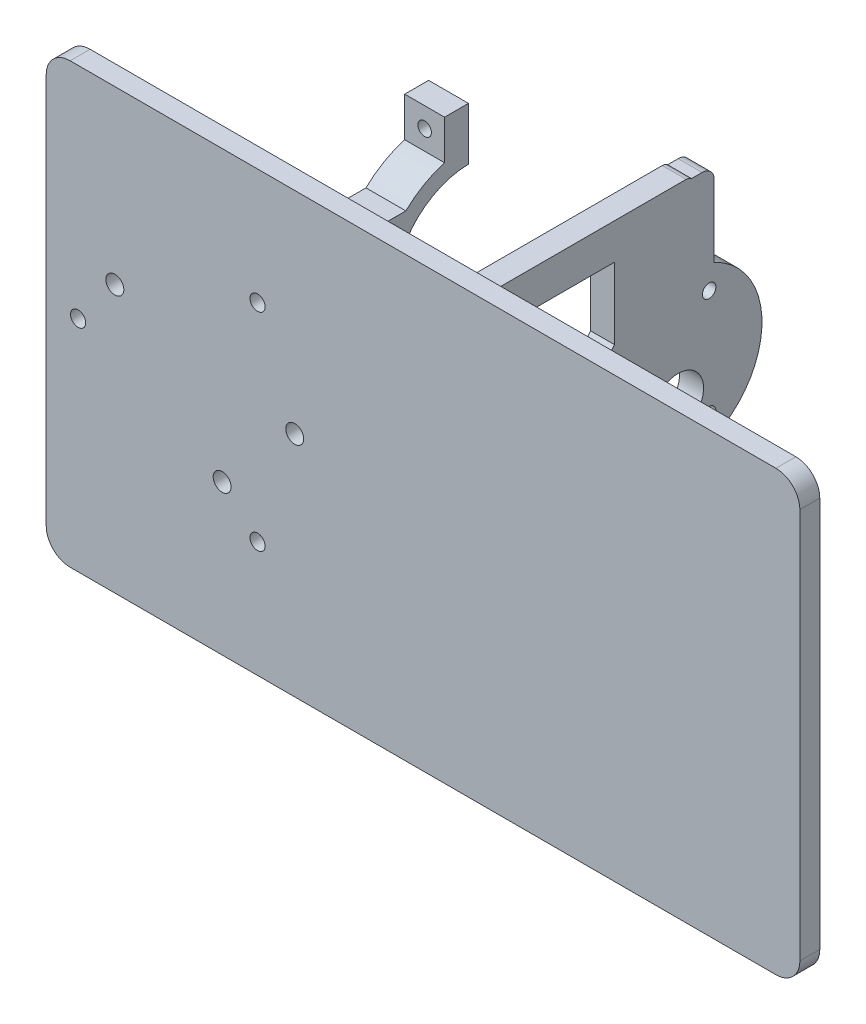
from build123d import *

# Parameters (mm, degrees)
F_01_SOLID_CASSETTE_DECK_DEPTH                 = 5
F_02_START                                     = -0.5
S02_THREE_MODULE_ATTACHMENT_HOLES_R            = 2.25
F_02_THREE_MODULE_ATTACHMENT_HOLES_DEPTH       = 6
F_03_START                                     = -0.5
S03_THREE_TENDON_PASSAGES_R                    = 1.9
F_03_THREE_TENDON_PASSAGES_DEPTH               = 6
F_04_START                                     = 29.980762114
S04_SHEAVE_1_INTEGRAL_CHEEK_1_R                = 2.2
F_04_SHEAVE_1_INTEGRAL_CHEEK_1_DEPTH           = 4
F_05_START                                     = 17.980762114
S05_SHEAVE_1_INTEGRAL_CHEEK_2_R                = 2.2
F_05_SHEAVE_1_INTEGRAL_CHEEK_2_DEPTH           = 4
F_06_START                                     = -21.980762114
S06_SHEAVE_2_INTEGRAL_CHEEK_1_R                = 2.2
F_06_SHEAVE_2_INTEGRAL_CHEEK_1_DEPTH           = 4
F_07_START                                     = -33.980762114
S07_SHEAVE_2_INTEGRAL_CHEEK_2_R                = 2.2
F_07_SHEAVE_2_INTEGRAL_CHEEK_2_DEPTH           = 4
F_08_START                                     = 4
S08_SHEAVE_3_INTEGRAL_CHEEK_1_R                = 2.2
F_08_SHEAVE_3_INTEGRAL_CHEEK_1_DEPTH           = 4
F_09_START                                     = -8
S09_SHEAVE_3_INTEGRAL_CHEEK_2_R                = 2.2
F_09_SHEAVE_3_INTEGRAL_CHEEK_2_DEPTH           = 4
F_10_START                                     = 57.5
F_10_OUTER_MOTOR_SUPPORT_43_DEPTH              = 6
F_11_START                                     = 57.5
F_11_OUTER_MOTOR_SUPPORT_43_DEPTH              = 6
F_12_START                                     = 57.5
F_12_MOTOR_FLANGE_CROSSMEMBER_BELOW_CORD_DEPTH = 6
F_13_START                                     = 57.5
S13_37D_FLANGE_BEARING_LAND_R                  = 21
F_13_37D_FLANGE_BEARING_LAND_DEPTH             = 6
F_14_START                                     = 57.3
S14_37D_PILOT_AND_THREE_M3_FACE_HOLES_R        = 6.35
S14_37D_PILOT_AND_THREE_M3_FACE_HOLES_R_2      = 1.7
F_14_37D_PILOT_AND_THREE_M3_FACE_HOLES_DEPTH   = 6.4
F_15_START                                     = 1.2
S15_REAR_MOTOR_CRADLE_ROOT_1_W                 = 40.8
S15_REAR_MOTOR_CRADLE_ROOT_1_H                 = 7
F_15_REAR_MOTOR_CRADLE_ROOT_1_DEPTH            = 10
F_16_START                                     = 1.2
S16_REAR_MOTOR_CRADLE_ROOT_2_W                 = 40.8
S16_REAR_MOTOR_CRADLE_ROOT_2_H                 = 7
F_16_REAR_MOTOR_CRADLE_ROOT_2_DEPTH            = 10
F_17_START                                     = 1.2
F_17_INTEGRAL_REAR_MOTOR_SADDLE_DEPTH          = 10
F_18_START                                     = 1
S18_37D_REAR_CAN_SUPPORT_R                     = 17.4
F_18_37D_REAR_CAN_SUPPORT_DEPTH                = 10.4
F_19_START                                     = 7.7
S19_LEAD_IN_CLEARANCE_FOR_GEARBOX_INST_R       = 18.8
F_19_LEAD_IN_CLEARANCE_FOR_GEARBOX_INSTA_DEPTH = 3.7
F_20_START                                     = -52
S20_MOTOR_SADDLE_CLAMP_SCREW_HOLES_R           = 1.7
F_20_MOTOR_SADDLE_CLAMP_SCREW_HOLES_DEPTH      = 7


with BuildPart() as part:
    # S01 - Solid cassette deck → 01 - Solid cassette deck (new body)
    with BuildSketch(Plane.XY):
        with BuildLine():
            Line((-32, -55), (145, -55))
            ThreePointArc((145, -55), (149.242640687, -53.242640687), (151, -49))
            Line((151, -49), (151, 49))
            ThreePointArc((151, 49), (149.242640687, 53.242640687), (145, 55))
            Line((145, 55), (-32, 55))
            ThreePointArc((-32, 55), (-36.242640687, 53.242640687), (-38, 49))
            Line((-38, 49), (-38, -49))
            ThreePointArc((-38, -49), (-36.242640687, -53.242640687), (-32, -55))
        make_face()
    extrude(amount=F_01_SOLID_CASSETTE_DECK_DEPTH)

    # S02 - Three module attachment holes → 02 - Three module attachment holes (cut)
    with BuildSketch(Plane.XY.offset(F_02_START)):
        with Locations((6.124355653, -17.392304845)):
            Circle(S02_THREE_MODULE_ATTACHMENT_HOLES_R)
        with Locations((24.320508076, 2.124355653)):
            Circle(S02_THREE_MODULE_ATTACHMENT_HOLES_R)
        with Locations((-20.784609691, 12)):
            Circle(S02_THREE_MODULE_ATTACHMENT_HOLES_R)
    extrude(amount=F_02_THREE_MODULE_ATTACHMENT_HOLES_DEPTH, mode=Mode.SUBTRACT)

    # S03 - Three tendon passages → 03 - Three tendon passages (cut)
    with BuildSketch(Plane.XY.offset(F_03_START)):
        with Locations((15, -25.980762114)):
            Circle(S03_THREE_TENDON_PASSAGES_R)
        with Locations((15, 25.980762114)):
            Circle(S03_THREE_TENDON_PASSAGES_R)
        with Locations((-30, 0)):
            Circle(S03_THREE_TENDON_PASSAGES_R)
    extrude(amount=F_03_THREE_TENDON_PASSAGES_DEPTH, mode=Mode.SUBTRACT)

    # S04 - Sheave 1 integral cheek 1 → 04 - Sheave 1 integral cheek 1 (add)
    with BuildSketch(Plane(origin=(0, 0, 0), x_dir=(-1, 0, 0), z_dir=(0, -1, 0)).offset(F_04_START)):
        with BuildLine():
            Line((-19.035615808, 14.404273897), (-20.535615808, 1.904273897))
            ThreePointArc((-20.535615808, 1.904273897), (-26.095726103, -2.464384192), (-30.464384192, 3.095726103))
            Line((-30.464384192, 3.095726103), (-28.964384192, 15.595726103))
            ThreePointArc((-28.964384192, 15.595726103), (-23.404273897, 19.964384192), (-19.035615808, 14.404273897))
        make_face()
        with Locations((-24, 15)):
            Circle(S04_SHEAVE_1_INTEGRAL_CHEEK_1_R, mode=Mode.SUBTRACT)
    extrude(amount=F_04_SHEAVE_1_INTEGRAL_CHEEK_1_DEPTH)

    # S05 - Sheave 1 integral cheek 2 → 05 - Sheave 1 integral cheek 2 (add)
    with BuildSketch(Plane(origin=(0, 0, 0), x_dir=(-1, 0, 0), z_dir=(0, -1, 0)).offset(F_05_START)):
        with BuildLine():
            Line((-19.035615808, 14.404273897), (-20.535615808, 1.904273897))
            ThreePointArc((-20.535615808, 1.904273897), (-26.095726103, -2.464384192), (-30.464384192, 3.095726103))
            Line((-30.464384192, 3.095726103), (-28.964384192, 15.595726103))
            ThreePointArc((-28.964384192, 15.595726103), (-23.404273897, 19.964384192), (-19.035615808, 14.404273897))
        make_face()
        with Locations((-24, 15)):
            Circle(S05_SHEAVE_1_INTEGRAL_CHEEK_2_R, mode=Mode.SUBTRACT)
    extrude(amount=F_05_SHEAVE_1_INTEGRAL_CHEEK_2_DEPTH)

    # S06 - Sheave 2 integral cheek 1 → 06 - Sheave 2 integral cheek 1 (add)
    with BuildSketch(Plane(origin=(0, 0, 0), x_dir=(-1, 0, 0), z_dir=(0, -1, 0)).offset(F_06_START)):
        with BuildLine():
            Line((-19.035615808, 14.404273897), (-20.535615808, 1.904273897))
            ThreePointArc((-20.535615808, 1.904273897), (-26.095726103, -2.464384192), (-30.464384192, 3.095726103))
            Line((-30.464384192, 3.095726103), (-28.964384192, 15.595726103))
            ThreePointArc((-28.964384192, 15.595726103), (-23.404273897, 19.964384192), (-19.035615808, 14.404273897))
        make_face()
        with Locations((-24, 15)):
            Circle(S06_SHEAVE_2_INTEGRAL_CHEEK_1_R, mode=Mode.SUBTRACT)
    extrude(amount=F_06_SHEAVE_2_INTEGRAL_CHEEK_1_DEPTH)

    # S07 - Sheave 2 integral cheek 2 → 07 - Sheave 2 integral cheek 2 (add)
    with BuildSketch(Plane(origin=(0, 0, 0), x_dir=(-1, 0, 0), z_dir=(0, -1, 0)).offset(F_07_START)):
        with BuildLine():
            Line((-19.035615808, 14.404273897), (-20.535615808, 1.904273897))
            ThreePointArc((-20.535615808, 1.904273897), (-26.095726103, -2.464384192), (-30.464384192, 3.095726103))
            Line((-30.464384192, 3.095726103), (-28.964384192, 15.595726103))
            ThreePointArc((-28.964384192, 15.595726103), (-23.404273897, 19.964384192), (-19.035615808, 14.404273897))
        make_face()
        with Locations((-24, 15)):
            Circle(S07_SHEAVE_2_INTEGRAL_CHEEK_2_R, mode=Mode.SUBTRACT)
    extrude(amount=F_07_SHEAVE_2_INTEGRAL_CHEEK_2_DEPTH)

    # S08 - Sheave 3 integral cheek 1 → 08 - Sheave 3 integral cheek 1 (add)
    with BuildSketch(Plane(origin=(0, 0, 0), x_dir=(-1, 0, 0), z_dir=(0, -1, 0)).offset(F_08_START)):
        with BuildLine():
            Line((25.964384192, 14.404273897), (24.464384192, 1.904273897))
            ThreePointArc((24.464384192, 1.904273897), (18.904273897, -2.464384192), (14.535615808, 3.095726103))
            Line((14.535615808, 3.095726103), (16.035615808, 15.595726103))
            ThreePointArc((16.035615808, 15.595726103), (21.595726103, 19.964384192), (25.964384192, 14.404273897))
        make_face()
        with Locations((21, 15)):
            Circle(S08_SHEAVE_3_INTEGRAL_CHEEK_1_R, mode=Mode.SUBTRACT)
    extrude(amount=F_08_SHEAVE_3_INTEGRAL_CHEEK_1_DEPTH)

    # S09 - Sheave 3 integral cheek 2 → 09 - Sheave 3 integral cheek 2 (add)
    with BuildSketch(Plane(origin=(0, 0, 0), x_dir=(-1, 0, 0), z_dir=(0, -1, 0)).offset(F_09_START)):
        with BuildLine():
            Line((25.964384192, 14.404273897), (24.464384192, 1.904273897))
            ThreePointArc((24.464384192, 1.904273897), (18.904273897, -2.464384192), (14.535615808, 3.095726103))
            Line((14.535615808, 3.095726103), (16.035615808, 15.595726103))
            ThreePointArc((16.035615808, 15.595726103), (21.595726103, 19.964384192), (25.964384192, 14.404273897))
        make_face()
        with Locations((21, 15)):
            Circle(S09_SHEAVE_3_INTEGRAL_CHEEK_2_R, mode=Mode.SUBTRACT)
    extrude(amount=F_09_SHEAVE_3_INTEGRAL_CHEEK_2_DEPTH)

    # S10 - Outer motor support -43 → 10 - Outer motor support -43 (add)
    with BuildSketch(Plane(origin=(0, 0, 0), x_dir=(0, 0, -1), z_dir=(1, 0, 0)).offset(F_10_START)):
        with BuildLine():
            Line((56, -45.5), (56, -40.5))
            ThreePointArc((56, -40.5), (55.414213562, -39.085786438), (54, -38.5))
            Line((54, -38.5), (0, -38.5))
            ThreePointArc((0, -38.5), (-1.414213562, -39.085786438), (-2, -40.5))
            Line((-2, -40.5), (-2, -45.5))
            ThreePointArc((-2, -45.5), (-1.414213562, -46.914213562), (0, -47.5))
            Line((0, -47.5), (54, -47.5))
            ThreePointArc((54, -47.5), (55.414213562, -46.914213562), (56, -45.5))
        make_face()
    extrude(amount=F_10_OUTER_MOTOR_SUPPORT_43_DEPTH)

    # S11 - Outer motor support 43 → 11 - Outer motor support 43 (add)
    with BuildSketch(Plane(origin=(0, 0, 0), x_dir=(0, 0, -1), z_dir=(1, 0, 0)).offset(F_11_START)):
        with BuildLine():
            Line((56, 40.5), (56, 45.5))
            ThreePointArc((56, 45.5), (55.414213562, 46.914213562), (54, 47.5))
            Line((54, 47.5), (0, 47.5))
            ThreePointArc((0, 47.5), (-1.414213562, 46.914213562), (-2, 45.5))
            Line((-2, 45.5), (-2, 40.5))
            ThreePointArc((-2, 40.5), (-1.414213562, 39.085786438), (0, 38.5))
            Line((0, 38.5), (54, 38.5))
            ThreePointArc((54, 38.5), (55.414213562, 39.085786438), (56, 40.5))
        make_face()
    extrude(amount=F_11_OUTER_MOTOR_SUPPORT_43_DEPTH)

    # S12 - Motor flange crossmember below cords → 12 - Motor flange crossmember below cords (add)
    with BuildSketch(Plane(origin=(0, 0, 0), x_dir=(0, 0, -1), z_dir=(1, 0, 0)).offset(F_12_START)):
        with BuildLine():
            Line((61, -44), (61, 44))
            ThreePointArc((61, 44), (60.121320344, 46.121320344), (58, 47))
            Line((58, 47), (39, 47))
            ThreePointArc((39, 47), (36.878679656, 46.121320344), (36, 44))
            Line((36, 44), (36, -44))
            ThreePointArc((36, -44), (36.878679656, -46.121320344), (39, -47))
            Line((39, -47), (58, -47))
            ThreePointArc((58, -47), (60.121320344, -46.121320344), (61, -44))
        make_face()
    extrude(amount=F_12_MOTOR_FLANGE_CROSSMEMBER_BELOW_CORD_DEPTH)

    # S13 - 37D flange bearing land → 13 - 37D flange bearing land (add)
    with BuildSketch(Plane(origin=(0, 0, 0), x_dir=(0, 0, -1), z_dir=(1, 0, 0)).offset(F_13_START)):
        with Locations((52, 7)):
            Circle(S13_37D_FLANGE_BEARING_LAND_R)
    extrude(amount=F_13_37D_FLANGE_BEARING_LAND_DEPTH)

    # S14 - 37D pilot and three M3 face holes → 14 - 37D pilot and three M3 face holes (cut)
    with BuildSketch(Plane(origin=(0, 0, 0), x_dir=(0, 0, -1), z_dir=(1, 0, 0)).offset(F_14_START)):
        with Locations((52, 0)):
            Circle(S14_37D_PILOT_AND_THREE_M3_FACE_HOLES_R)
        with Locations((36.5, 7)):
            Circle(S14_37D_PILOT_AND_THREE_M3_FACE_HOLES_R_2)
        with Locations((59.75, -6.423393759)):
            Circle(S14_37D_PILOT_AND_THREE_M3_FACE_HOLES_R_2)
        with Locations((59.75, 20.423393759)):
            Circle(S14_37D_PILOT_AND_THREE_M3_FACE_HOLES_R_2)
    extrude(amount=F_14_37D_PILOT_AND_THREE_M3_FACE_HOLES_DEPTH, mode=Mode.SUBTRACT)

    # S15 - Rear motor cradle root 1 → 15 - Rear motor cradle root 1 (add)
    with BuildSketch(Plane(origin=(0, 0, 0), x_dir=(0, 0, -1), z_dir=(1, 0, 0)).offset(F_15_START)):
        with Locations((19.6, -10)):
            Rectangle(S15_REAR_MOTOR_CRADLE_ROOT_1_W, S15_REAR_MOTOR_CRADLE_ROOT_1_H)
    extrude(amount=F_15_REAR_MOTOR_CRADLE_ROOT_1_DEPTH)

    # S16 - Rear motor cradle root 2 → 16 - Rear motor cradle root 2 (add)
    with BuildSketch(Plane(origin=(0, 0, 0), x_dir=(0, 0, -1), z_dir=(1, 0, 0)).offset(F_16_START)):
        with Locations((19.6, 20)):
            Rectangle(S16_REAR_MOTOR_CRADLE_ROOT_2_W, S16_REAR_MOTOR_CRADLE_ROOT_2_H)
    extrude(amount=F_16_REAR_MOTOR_CRADLE_ROOT_2_DEPTH)

    # S17 - Integral rear motor saddle → 17 - Integral rear motor saddle (add)
    with BuildSketch(Plane(origin=(0, 0, 0), x_dir=(0, 0, -1), z_dir=(1, 0, 0)).offset(F_17_START)):
        with BuildLine():
            Line((51.7, -25), (45.7, -25))
            Line((45.7, -25), (45.7, -15.1))
            ThreePointArc((45.7, -15.1), (29, 7), (45.7, 29.1))
            Line((45.7, 29.1), (45.7, 39))
            Line((45.7, 39), (51.7, 39))
            Line((51.7, 39), (51.7, -25))
        make_face()
    extrude(amount=F_17_INTEGRAL_REAR_MOTOR_SADDLE_DEPTH)

    # S18 - 37D rear can support → 18 - 37D rear can support (cut)
    with BuildSketch(Plane(origin=(0, 0, 0), x_dir=(0, 0, -1), z_dir=(1, 0, 0)).offset(F_18_START)):
        with Locations((52, 7)):
            Circle(S18_37D_REAR_CAN_SUPPORT_R)
    extrude(amount=F_18_37D_REAR_CAN_SUPPORT_DEPTH, mode=Mode.SUBTRACT)

    # S19 - Lead-in clearance for gearbox installation → 19 - Lead-in clearance for gearbox installation (cut)
    with BuildSketch(Plane(origin=(0, 0, 0), x_dir=(0, 0, -1), z_dir=(1, 0, 0)).offset(F_19_START)):
        with Locations((52, 7)):
            Circle(S19_LEAD_IN_CLEARANCE_FOR_GEARBOX_INST_R)
    extrude(amount=F_19_LEAD_IN_CLEARANCE_FOR_GEARBOX_INSTA_DEPTH, mode=Mode.SUBTRACT)

    # S20 - Motor saddle clamp screw holes → 20 - Motor saddle clamp screw holes (cut)
    with BuildSketch(Plane.XY.offset(F_20_START)):
        with Locations((6.2, -20)):
            Circle(S20_MOTOR_SADDLE_CLAMP_SCREW_HOLES_R)
        with Locations((6.2, 34)):
            Circle(S20_MOTOR_SADDLE_CLAMP_SCREW_HOLES_R)
    extrude(amount=F_20_MOTOR_SADDLE_CLAMP_SCREW_HOLES_DEPTH, mode=Mode.SUBTRACT)


solid = part.part
